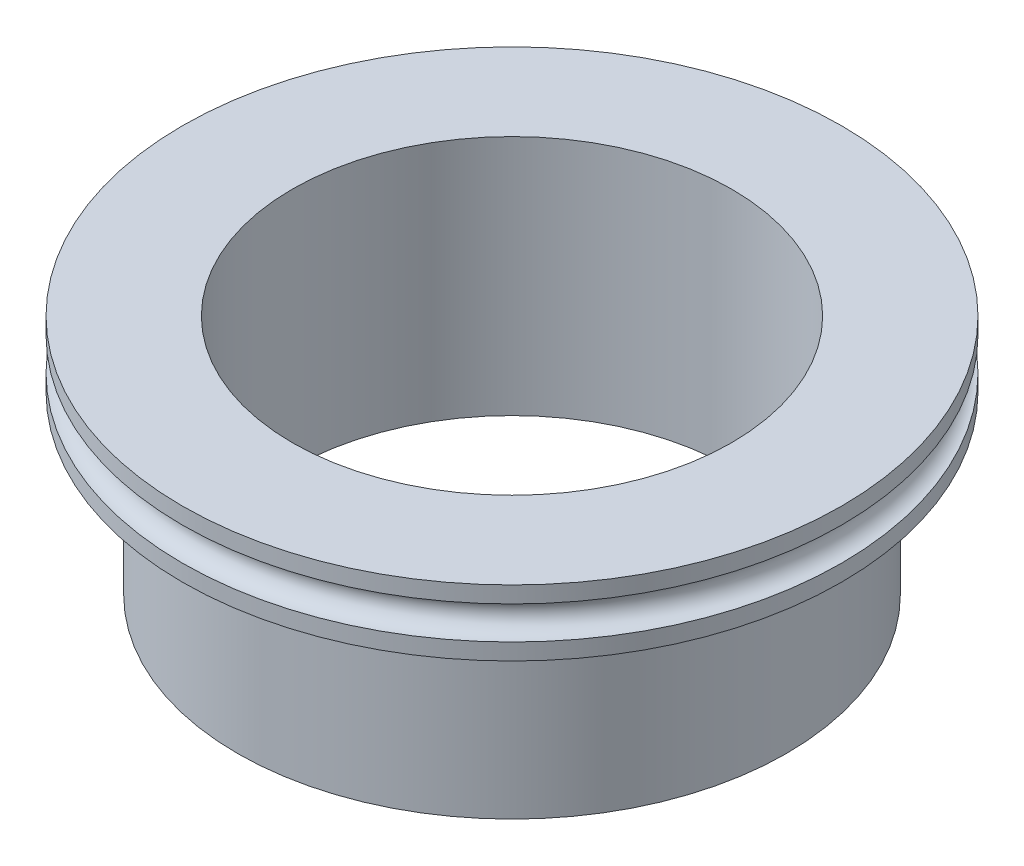
from build123d import *

# Parameters (mm, degrees)
CROQUIS1_R              = 15
SALIENTE_EXTRUIR1_DEPTH = 1.5
CROQUIS2_R              = 0.75
CROQUIS4_R              = 12.5
SALIENTE_EXTRUIR2_DEPTH = 8
CROQUIS3_R              = 10
CORTAR_EXTRUIR1_DEPTH   = 24.895606291


with BuildPart() as part:
    # Croquis1 → Saliente-Extruir1 (new, symmetric)
    with BuildSketch(Plane(origin=(0, 0, 0), x_dir=(1, 0, 0), z_dir=(0, 1, 0))):
        with Locations(Location((0, 0, 0), (0, 0, 270))):
            Circle(CROQUIS1_R)
    extrude(amount=SALIENTE_EXTRUIR1_DEPTH, both=True)

    # Croquis2 → Cortar-Revolución1 (revolve, cut)
    with BuildSketch(Plane(origin=(0, 0, 0), x_dir=(0, 0, -1), z_dir=(1, 0, 0)), mode=Mode.PRIVATE) as cortar_revoluci_n1_sk:
        with Locations((15, 0)):
            Circle(CROQUIS2_R)
    revolve(cortar_revoluci_n1_sk.sketch.rotate(Axis((0, 1.5, 0), (0, -1, 0)), 180), axis=Axis((0, 1.5, 0), (0, -1, 0)), mode=Mode.SUBTRACT)

    # Croquis4 → Saliente-Extruir2 (add)
    with BuildSketch(Plane.XZ.offset(1.5)):
        with Locations(Location((0, 0, 0), (0, 0, 90))):
            Circle(CROQUIS4_R)
    extrude(amount=SALIENTE_EXTRUIR2_DEPTH)

    # Croquis3 → Cortar-Extruir1 (cut, through all)
    with BuildSketch(Plane(origin=(0, 1.5, 0), x_dir=(1, 0, 0), z_dir=(0, 1, 0))):
        with Locations(Location((0, 0, 0), (0, 0, 270))):
            Circle(CROQUIS3_R)
    extrude(amount=-CORTAR_EXTRUIR1_DEPTH, mode=Mode.SUBTRACT)


solid = part.part
